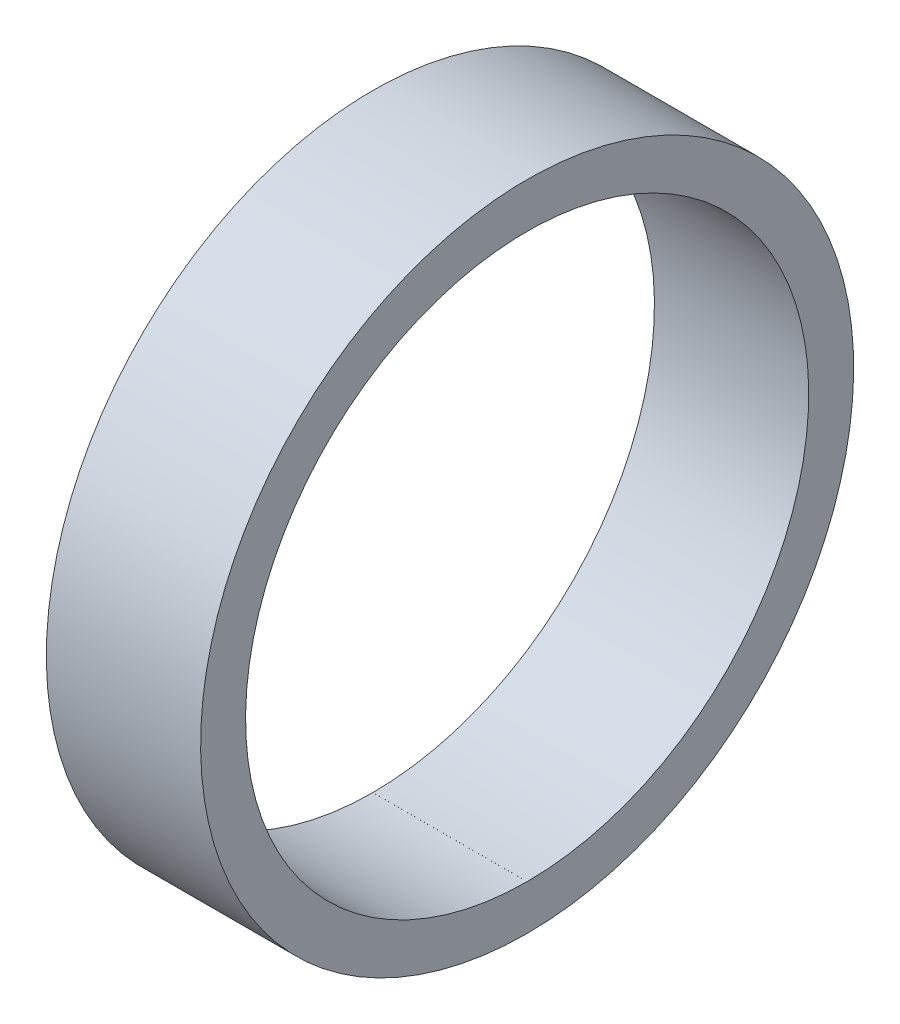
from build123d import *

# Parameters (mm, degrees)
SKETCH1_W           = 26.162
SKETCH1_H           = 7.62
REVOLVE_THIN1_ANGLE = 359.99


with BuildPart() as part:
    # Sketch1 → Revolve-Thin1 (revolve)
    with BuildSketch(Plane.XY):
        with Locations((13.081, -3.81)):
            Rectangle(SKETCH1_W, SKETCH1_H)
    revolve(axis=Axis((0, 47.752, 0), (1, 0, 0)), revolution_arc=REVOLVE_THIN1_ANGLE)


solid = part.part
